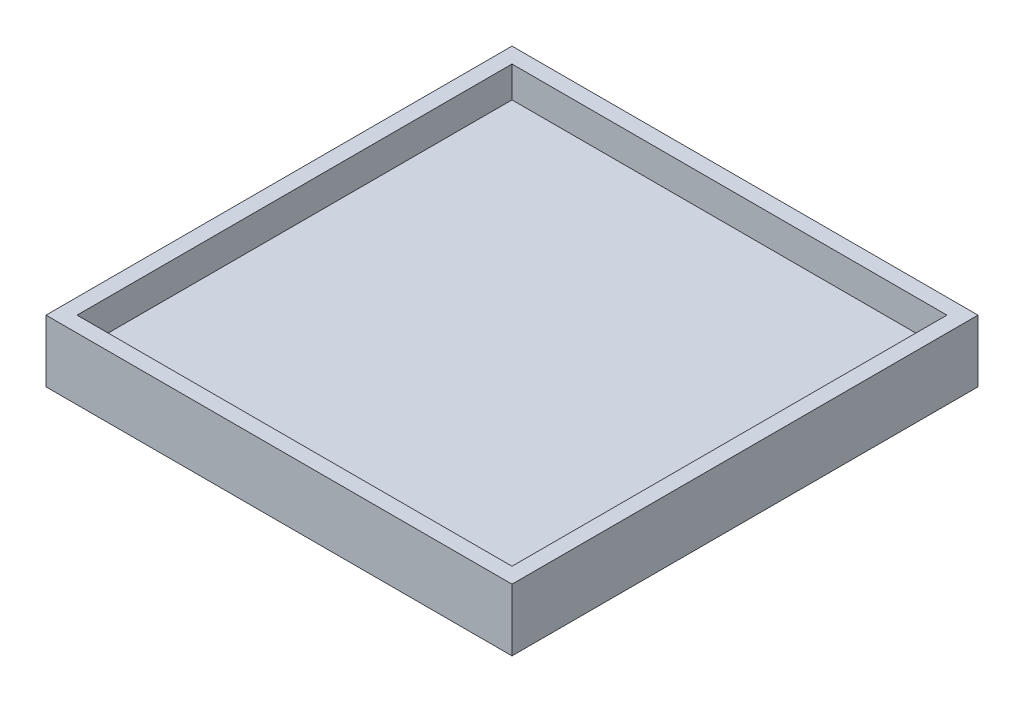
from build123d import *

# Parameters (mm, degrees)
SKETCH1_W           = 76.2
SKETCH1_H           = 76.2
BOSS_EXTRUDE1_DEPTH = 10.16
SKETCH4_W           = 71.12
SKETCH4_H           = 71.12
CUT_EXTRUDE1_DEPTH  = 5.08


with BuildPart() as part:
    # Sketch1 → Boss-Extrude1 (new body)
    with BuildSketch(Plane(origin=(0, 0, 0), x_dir=(1, 0, 0), z_dir=(0, 1, 0))):
        with Locations((1.558790409, 2.412556988)):
            Rectangle(SKETCH1_W, SKETCH1_H)
    extrude(amount=BOSS_EXTRUDE1_DEPTH)

    # Sketch4 → Cut-Extrude1 (cut)
    with BuildSketch(Plane(origin=(0, 10.16, 0), x_dir=(1, 0, 0), z_dir=(0, 1, 0))):
        with Locations((1.558790409, 2.412556988)):
            Rectangle(SKETCH4_W, SKETCH4_H)
    extrude(amount=-CUT_EXTRUDE1_DEPTH, mode=Mode.SUBTRACT)


solid = part.part
